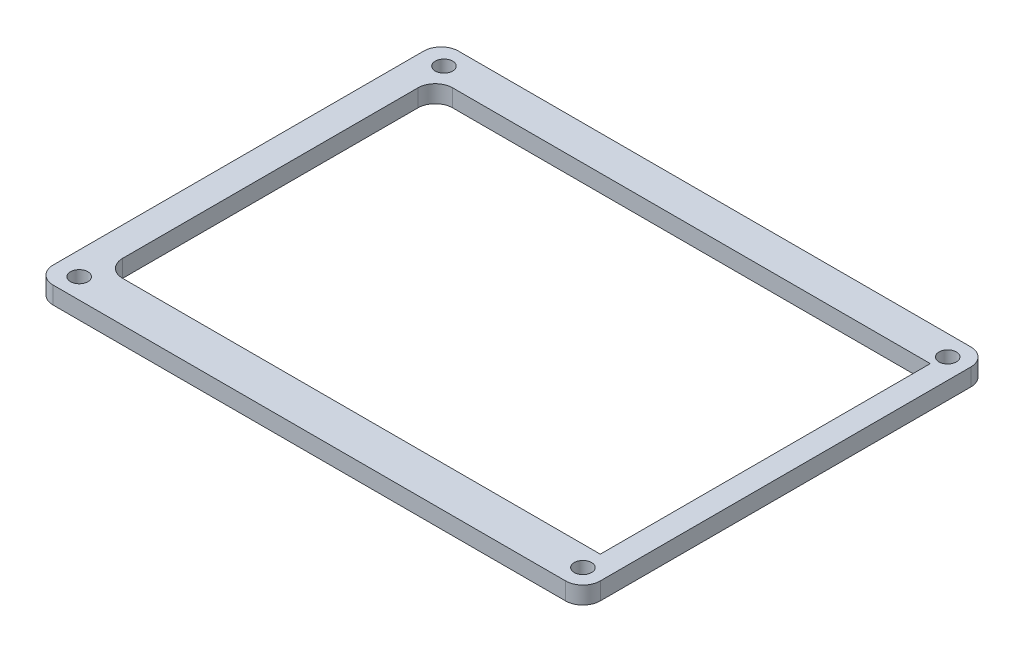
from build123d import *

# Parameters (mm, degrees)
SKETCH1_W           = 94.5
SKETCH1_H           = 70
BOSS_EXTRUDE1_DEPTH = 3
SKETCH3_R           = 1.5
CUT_EXTRUDE2_DEPTH  = 59.877521177
FILLET2_R           = 3
CUT_EXTRUDE3_DEPTH  = 59.877521177
FILLET3_R           = 3


with BuildPart() as part:
    # Sketch1 → Boss-Extrude1 (new body)
    with BuildSketch(Plane(origin=(0, 0, 0), x_dir=(1, 0, 0), z_dir=(0, 1, 0))):
        Rectangle(SKETCH1_W, SKETCH1_H)
    extrude(amount=BOSS_EXTRUDE1_DEPTH)

    # Sketch3 → Cut-Extrude2 (cut, through all)
    with BuildSketch(Plane(origin=(0, 3, 0), x_dir=(1, 0, 0), z_dir=(0, 1, 0))):
        with Locations(Location((43.75, 31.5, 0), (0, 0, 270))):
            Circle(SKETCH3_R)
        with Locations(Location((-43.25, 31.5, 0), (0, 0, 270))):
            Circle(SKETCH3_R)
        with Locations(Location((-43.25, -31.5, 0), (0, 0, 270))):
            Circle(SKETCH3_R)
        with Locations(Location((43.75, -31.5, 0), (0, 0, 270))):
            Circle(SKETCH3_R)
    extrude(amount=-CUT_EXTRUDE2_DEPTH, mode=Mode.SUBTRACT)

    # Fillet2
    fillet2_edges = [part.edges().sort_by_distance(p)[0] for p in [
        (47.25, 1.5, 35),
        (-47.25, 1.5, 35),
        (-47.25, 1.5, -35),
        (47.25, 1.5, -35),
    ]]
    fillet(fillet2_edges, radius=FILLET2_R)

    # Sketch5 → Cut-Extrude3 (cut, through all)
    with BuildSketch(Plane(origin=(0, 3, 0), x_dir=(1, 0, 0), z_dir=(0, 1, 0))):
        Polygon((43.25, 29), (-42.25, 29), (-42.25, 10), (-42.25, -10), (-42.25, -28), (-35, -28), (43.25, -28), align=None)
    extrude(amount=-CUT_EXTRUDE3_DEPTH, mode=Mode.SUBTRACT)

    # Fillet3
    fillet3_edges = [part.edges().sort_by_distance(p)[0] for p in [
        (-42.25, 1.5, 28),
        (-42.25, 1.5, -29),
    ]]
    fillet(fillet3_edges, radius=FILLET3_R)


solid = part.part
